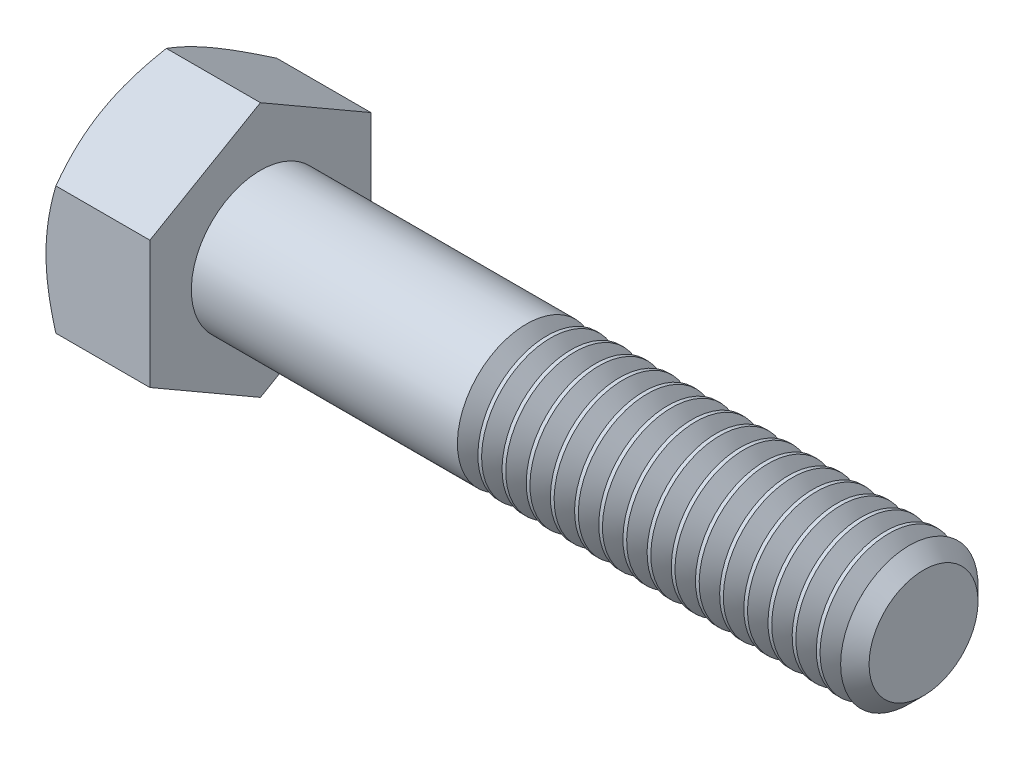
from build123d import *

# Parameters (mm, degrees)
BASEHEAD_DEPTH  = 5.969
THDSCHPAT_COUNT = 16
THDSCHPAT_PITCH = 1.3890625


with BuildPart() as part:
    # Sketch1 → BaseHead (new body)
    with BuildSketch(Plane(origin=(0, 0, 0), x_dir=(0, 0, -1), z_dir=(1, 0, 0))):
        Polygon((6.35, 3.666174209), (6.35, -3.666174209), (0, -7.332348419), (-6.35, -3.666174209), (-6.35, 3.666174209), (0, 7.332348419), align=None)
    extrude(amount=BASEHEAD_DEPTH)

    # BodySke → BaseBody (revolve)
    with BuildSketch(Plane.XY, mode=Mode.PRIVATE) as basebody_sk:
        Polygon((0, 0), (44.069, 0), (44.069, 3.12928), (43.22953, 3.96875), (0, 3.96875), align=None)
    revolve(basebody_sk.sketch.rotate(Axis((0, 0, 0), (1, 0, 0)), 90), axis=Axis((0, 0, 0), (1, 0, 0)))

    # Sketch3 → HeadChamfer (revolve, cut)
    with BuildSketch(Plane.XY):
        Polygon((0, 6.35), (4.233333333, 13.682348419), (4.233333333, 20.032348419), (-12.7, 20.032348419), (-12.7, 6.35), align=None)
    revolve(axis=Axis((0, 0, 0), (1, 0, 0)), mode=Mode.SUBTRACT)

    # ThdSchSke → ThreadSchematic (revolve, cut)
    with BuildSketch(Plane.XY):
        Polygon((21.844, -3.12928), (21.256196778, -3.96875), (21.256196778, -4.9609375), (22.431803222, -4.9609375), (22.431803222, -3.96875), align=None)
    threadschematic = revolve(axis=Axis((-3.175, 0, 0), (1, 0, 0)), mode=Mode.SUBTRACT)

    # ThdSchPat: ThreadSchematic ×16
    with Locations(*[(i * THDSCHPAT_PITCH, 0, 0) for i in range(1, THDSCHPAT_COUNT)]):
        add(threadschematic, mode=Mode.SUBTRACT)


solid = part.part
